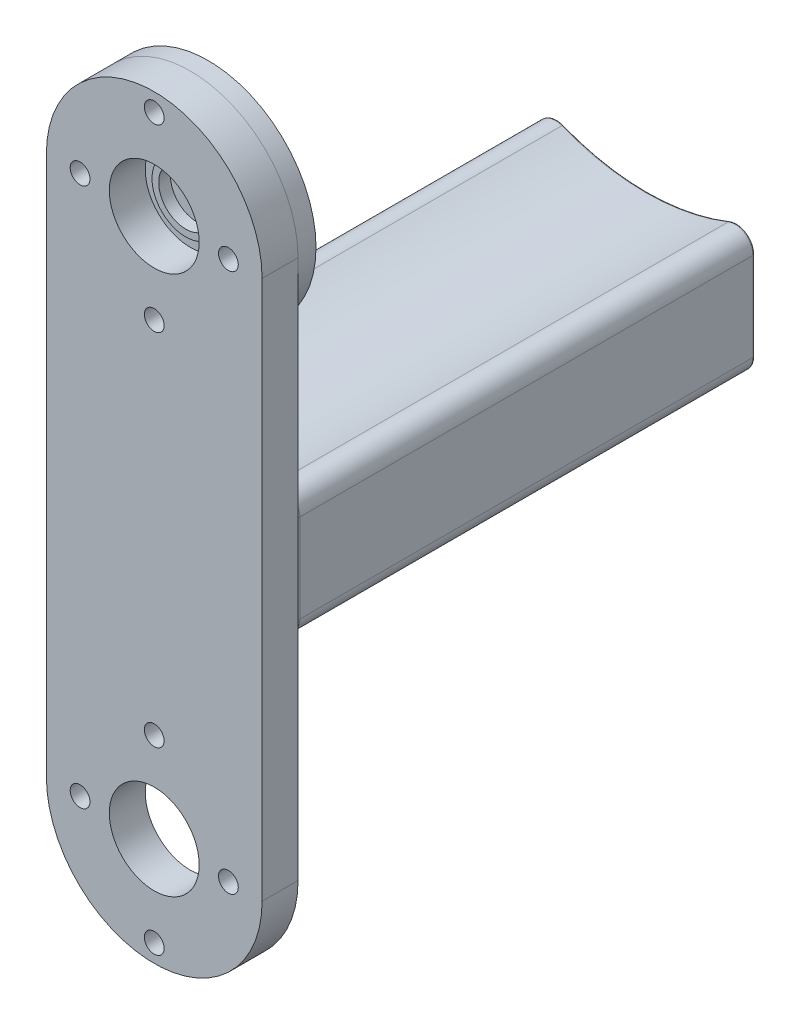
from build123d import *

# Parameters (mm, degrees)
SKETCH_2_R          = 0.75
CUT_EXTRUDE_1_DEPTH = 18.557049866
SKETCH_1_2_R        = 5
SKETCH_1_2_R_2      = 1.1
EXTRUDE_1_DEPTH     = 4
SKETCH_2_2_R        = 1.1
SKETCH_2_2_R_2      = 0.95
EXTRUDE_2_DEPTH     = 50.8
FILLET_1_R          = 0.2


with BuildPart() as part:
    # Sketch 1 → Повернуть1 (revolve)
    with BuildSketch(Plane(origin=(0, 0, 0), x_dir=(0, 0, -1), z_dir=(1, 0, 0)), mode=Mode.PRIVATE) as revolve_1_sk:
        Polygon((0, 3.75), (0, 12), (2, 12), (2, 4.5), (4.5, 4.5), (4.5, 3), (1.5, 3), (1.5, 1.4), (0.8, 1.4), (0.8, 3), (-0.5, 3), (-0.5, 3.75), align=None)
    revolve(revolve_1_sk.sketch.rotate(Axis((0, 0, 50), (0, 0, -1)), 90), axis=Axis((0, 0, 50), (0, 0, -1)))

    # Sketch 2 → Вырез-Вытянуть1 (cut, through all)
    with BuildSketch(Plane.XY):
        with Locations((8.25, 0)):
            Circle(SKETCH_2_R)
        with Locations((7.752464121, -2.821666182)):
            Circle(SKETCH_2_R)
        with Locations((7.752464121, 2.821666182)):
            Circle(SKETCH_2_R)
        with Locations((-8.25, 0)):
            Circle(SKETCH_2_R)
        with Locations((-7.752464121, -2.821666182)):
            Circle(SKETCH_2_R)
        with Locations((-7.752464121, 2.821666182)):
            Circle(SKETCH_2_R)
        with Locations((0, 7)):
            Circle(SKETCH_2_R)
        with Locations((0, 10)):
            Circle(SKETCH_2_R)
        with Locations((2.394141003, 6.577848346)):
            Circle(SKETCH_2_R)
        with Locations((3.420201433, 9.396926208)):
            Circle(SKETCH_2_R)
        with Locations((-2.394141003, 6.577848346)):
            Circle(SKETCH_2_R)
        with Locations((-3.420201433, 9.396926208)):
            Circle(SKETCH_2_R)
        with Locations((0, -7)):
            Circle(SKETCH_2_R)
        with Locations((0, -10)):
            Circle(SKETCH_2_R)
        with Locations((3.420201433, -9.396926208)):
            Circle(SKETCH_2_R)
        with Locations((2.394141003, -6.577848346)):
            Circle(SKETCH_2_R)
        with Locations((-2.394141003, -6.577848346)):
            Circle(SKETCH_2_R)
        with Locations((-3.420201433, -9.396926208)):
            Circle(SKETCH_2_R)
    extrude(amount=-CUT_EXTRUDE_1_DEPTH, mode=Mode.SUBTRACT)


with BuildPart() as body_2:
    # Sketch 1 2 → 보스-돌출1 (new body)
    with BuildSketch(Plane.XY):
        with BuildLine():
            Line((-12, 0), (-12, -60))
            ThreePointArc((-12, -60), (0, -72), (12, -60))
            Line((12, -60), (12, 0))
            ThreePointArc((12, 0), (0, 12), (-12, 0))
        make_face()
        Circle(SKETCH_1_2_R, mode=Mode.SUBTRACT)
        with Locations((0, -60)):
            Circle(SKETCH_1_2_R, mode=Mode.SUBTRACT)
        with Locations((-8.25, 0)):
            Circle(SKETCH_1_2_R_2, mode=Mode.SUBTRACT)
        with Locations((0, 10)):
            Circle(SKETCH_1_2_R_2, mode=Mode.SUBTRACT)
        with Locations((8.25, 0)):
            Circle(SKETCH_1_2_R_2, mode=Mode.SUBTRACT)
        with Locations((0, -10)):
            Circle(SKETCH_1_2_R_2, mode=Mode.SUBTRACT)
        with Locations((0, -50)):
            Circle(SKETCH_1_2_R_2, mode=Mode.SUBTRACT)
        with Locations((8.25, -60)):
            Circle(SKETCH_1_2_R_2, mode=Mode.SUBTRACT)
        with Locations((-8.25, -60)):
            Circle(SKETCH_1_2_R_2, mode=Mode.SUBTRACT)
        with Locations((0, -70)):
            Circle(SKETCH_1_2_R_2, mode=Mode.SUBTRACT)
    extrude(amount=EXTRUDE_1_DEPTH)


with BuildPart() as body_3:
    # Sketch 2 2 → 보스-돌출2 (new body)
    # profile 1 of 7: a face of its own
    with BuildSketch(Plane(origin=(0, 0, 0), x_dir=(-1, 0, 0), z_dir=(0, 0, -1))):
        with BuildLine():
            ThreePointArc((9.259259259, -36.777895919), (11.122167215, -36.575645862), (12, -34.920127592))
            Line((12, -34.920127592), (12, -25.079872408))
            ThreePointArc((12, -25.079872408), (11.122167215, -23.424354138), (9.259259259, -23.222104081))
            ThreePointArc((9.259259259, -23.222104081), (0, -25), (-9.259259259, -23.222104081))
            ThreePointArc((-9.259259259, -23.222104081), (-11.122167215, -23.424354138), (-12, -25.079872408))
            Line((-12, -25.079872408), (-12, -34.920127592))
            ThreePointArc((-12, -34.920127592), (-11.122167215, -36.575645862), (-9.259259259, -36.777895919))
            ThreePointArc((-9.259259259, -36.777895919), (0, -35), (9.259259259, -36.777895919))
        make_face()
        with Locations((-10, -34.920127592)):
            Circle(SKETCH_2_2_R, mode=Mode.SUBTRACT)
        with Locations((10, -34.920127592)):
            Circle(SKETCH_2_2_R, mode=Mode.SUBTRACT)
        with Locations((-10, -25.079872408)):
            Circle(SKETCH_2_2_R, mode=Mode.SUBTRACT)
        with Locations((-4, -30)):
            Circle(SKETCH_2_2_R, mode=Mode.SUBTRACT)
        with Locations((4, -30)):
            Circle(SKETCH_2_2_R, mode=Mode.SUBTRACT)
        with Locations((10, -25.079872408)):
            Circle(SKETCH_2_2_R, mode=Mode.SUBTRACT)
    # profile 2 of 7: a face of its own
    with BuildSketch(Plane(origin=(0, 0, 0), x_dir=(-1, 0, 0), z_dir=(0, 0, -1))):
        with Locations((-10, -34.920127592)):
            Circle(SKETCH_2_2_R)
        with Locations((-10, -34.920127592)):
            Circle(SKETCH_2_2_R_2, mode=Mode.SUBTRACT)
    # profile 3 of 7: a face of its own
    with BuildSketch(Plane(origin=(0, 0, 0), x_dir=(-1, 0, 0), z_dir=(0, 0, -1))):
        with Locations((10, -34.920127592)):
            Circle(SKETCH_2_2_R)
        with Locations((10, -34.920127592)):
            Circle(SKETCH_2_2_R_2, mode=Mode.SUBTRACT)
    # profile 4 of 7: a face of its own
    with BuildSketch(Plane(origin=(0, 0, 0), x_dir=(-1, 0, 0), z_dir=(0, 0, -1))):
        with Locations((10, -25.079872408)):
            Circle(SKETCH_2_2_R)
        with Locations((10, -25.079872408)):
            Circle(SKETCH_2_2_R_2, mode=Mode.SUBTRACT)
    # profile 5 of 7: a face of its own
    with BuildSketch(Plane(origin=(0, 0, 0), x_dir=(-1, 0, 0), z_dir=(0, 0, -1))):
        with Locations((4, -30)):
            Circle(SKETCH_2_2_R)
        with Locations((4, -30)):
            Circle(SKETCH_2_2_R_2, mode=Mode.SUBTRACT)
    # profile 6 of 7: a face of its own
    with BuildSketch(Plane(origin=(0, 0, 0), x_dir=(-1, 0, 0), z_dir=(0, 0, -1))):
        with Locations((-4, -30)):
            Circle(SKETCH_2_2_R)
        with Locations((-4, -30)):
            Circle(SKETCH_2_2_R_2, mode=Mode.SUBTRACT)
    # profile 7 of 7: a face of its own
    with BuildSketch(Plane(origin=(0, 0, 0), x_dir=(-1, 0, 0), z_dir=(0, 0, -1))):
        with Locations((-10, -25.079872408)):
            Circle(SKETCH_2_2_R)
        with Locations((-10, -25.079872408)):
            Circle(SKETCH_2_2_R_2, mode=Mode.SUBTRACT)
    extrude(amount=EXTRUDE_2_DEPTH)

    # 필렛1
    fillet_1_edges = [body_3.edges().sort_by_distance(p)[0] for p in [
        (10.95, -25.079872408, -50.8),
        (0, -25, -50.8),
        (10.95, -34.920127592, 0),
        (-9.05, -34.920127592, 0),
        (-9.05, -25.079872408, 0),
        (-3.05, -30, 0),
        (4.95, -30, 0),
        (-11.122167215, -23.424354138, 0),
        (-12, -30, 0),
        (-11.122167215, -36.575645862, 0),
        (11.122167215, -23.424354138, -50.8),
        (0, -35, 0),
        (11.122167215, -36.575645862, 0),
        (12, -30, 0),
        (11.122167215, -23.424354138, 0),
        (0, -25, 0),
        (10.95, -25.079872408, 0),
        (12, -30, -50.8),
        (11.122167215, -36.575645862, -50.8),
        (0, -35, -50.8),
        (-11.122167215, -36.575645862, -50.8),
        (-12, -30, -50.8),
        (-11.122167215, -23.424354138, -50.8),
        (4.95, -30, -50.8),
        (-3.05, -30, -50.8),
        (-9.05, -25.079872408, -50.8),
        (-9.05, -34.920127592, -50.8),
        (10.95, -34.920127592, -50.8),
    ]]
    fillet(fillet_1_edges, radius=FILLET_1_R)


solid = Compound([part.part, body_2.part, body_3.part])
